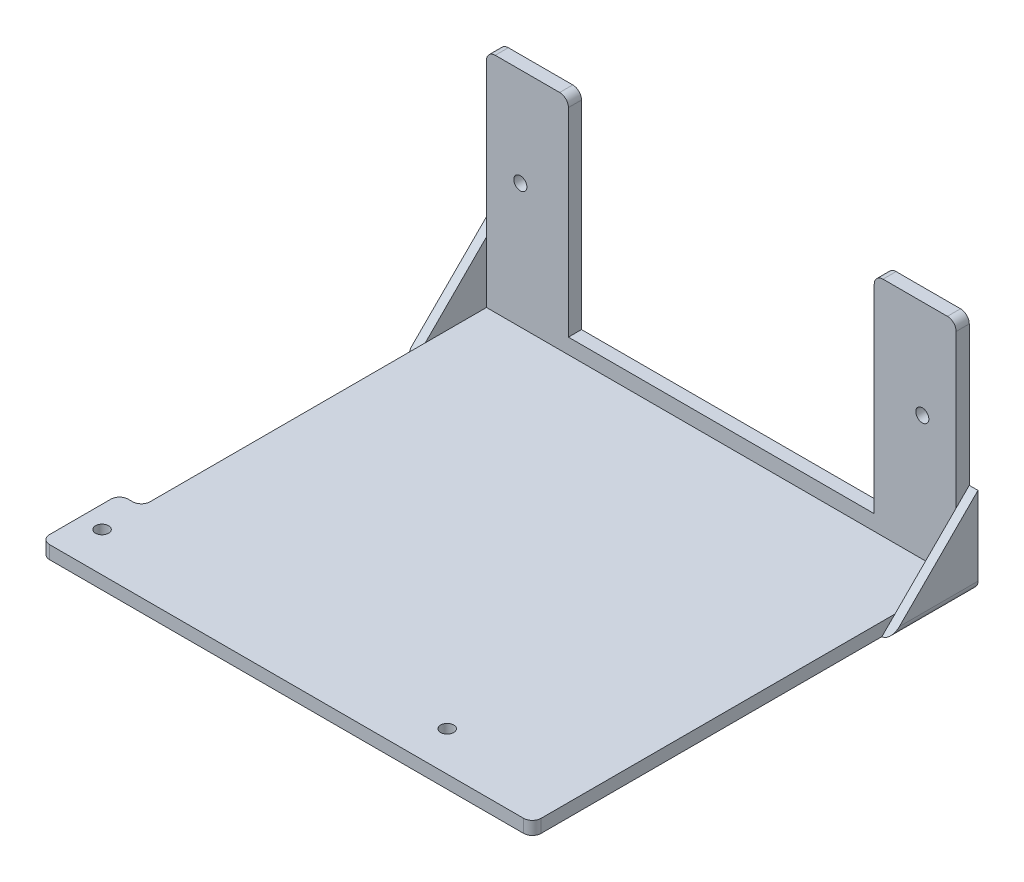
from build123d import *

# Parameters (mm, degrees)
SKETCH_1_W          = 107.5
SKETCH_1_H          = 54
EXTRUDE_1_DEPTH     = 3
SKETCH_2_W          = 107.5
SKETCH_2_H          = 3
EXTRUDE_2_DEPTH     = 97
SKETCH_4_W          = 5
SKETCH_4_H          = 18
EXTRUDE_3_DEPTH     = 3
SKETCH_5_R          = 1.5
CUT_EXTRUDE_1_DEPTH = 3
SKETCH_6_W          = 70
SKETCH_6_H          = 47.5
CUT_EXTRUDE_2_DEPTH = 3
SKETCH_7_R          = 1.5
CUT_EXTRUDE_3_DEPTH = 3
EXTRUDE_4_DEPTH     = 2
EXTRUDE_5_DEPTH     = 2
FILLET_1_R          = 2
FILLET_2_R          = 2


with BuildPart() as part:
    # 草图1 → 凸台-拉伸1 (new body)
    with BuildSketch(Plane.XY):
        with Locations((0, 27)):
            Rectangle(SKETCH_1_W, SKETCH_1_H)
    extrude(amount=EXTRUDE_1_DEPTH)

    # 草图2 → 凸台-拉伸2 (add)
    with BuildSketch(Plane.XY.offset(3)):
        with Locations((0, 1.5)):
            Rectangle(SKETCH_2_W, SKETCH_2_H)
    extrude(amount=EXTRUDE_2_DEPTH)

    # 草图4 → 凸台-拉伸3 (add)
    with BuildSketch(Plane(origin=(0, 3, 0), x_dir=(1, 0, 0), z_dir=(0, 1, 0))):
        with Locations((-56.25, -91)):
            Rectangle(SKETCH_4_W, SKETCH_4_H)
    extrude(amount=-EXTRUDE_3_DEPTH)

    # 草图5 → 切除-拉伸1 (cut)
    with BuildSketch(Plane(origin=(0, 3, 0), x_dir=(1, 0, 0), z_dir=(0, 1, 0))):
        with Locations(Location((-53.75, -91, 0), (0, 0, 180))):
            Circle(SKETCH_5_R)
        with Locations(Location((25.25, -91, 0), (0, 0, 180))):
            Circle(SKETCH_5_R)
    extrude(amount=-CUT_EXTRUDE_1_DEPTH, mode=Mode.SUBTRACT)

    # 草图6 → 切除-拉伸2 (cut)
    with BuildSketch(Plane.XY.offset(3)):
        with Locations((0, 30.25)):
            Rectangle(SKETCH_6_W, SKETCH_6_H)
    extrude(amount=-CUT_EXTRUDE_2_DEPTH, mode=Mode.SUBTRACT)

    # 草图7 → 切除-拉伸3 (cut)
    with BuildSketch(Plane.XY.offset(3)):
        with Locations((46, 31.5)):
            Circle(SKETCH_7_R)
        with Locations((-46, 31.5)):
            Circle(SKETCH_7_R)
    extrude(amount=-CUT_EXTRUDE_3_DEPTH, mode=Mode.SUBTRACT)

    # 草图8 → 凸台-拉伸4 (add)
    with BuildSketch(Plane.ZY.offset(53.75)):
        Polygon((0, 0), (20, 0), (0, 20), align=None)
    extrude(amount=EXTRUDE_4_DEPTH)

    # 草图9 → 凸台-拉伸5 (add)
    with BuildSketch(Plane(origin=(53.75, 0, 0), x_dir=(0, 0, -1), z_dir=(1, 0, 0))):
        Polygon((0, 0), (0, 20), (-20, 0), align=None)
    extrude(amount=EXTRUDE_5_DEPTH)

    # 圆角1
    fillet_1_edges = [part.edges().sort_by_distance(p)[0] for p in [
        (-55.75, 0, 10),
        (55.75, 0, 10),
        (53.75, 54, 1.5),
        (35, 54, 1.5),
        (-35, 54, 1.5),
        (-53.75, 54, 1.5),
    ]]
    fillet(fillet_1_edges, radius=FILLET_1_R)

    # 圆角2
    fillet_2_edges = [part.edges().sort_by_distance(p)[0] for p in [
        (53.75, 1.5, 100),
        (-53.75, 1.5, 82),
        (-58.75, 1.5, 100),
        (-58.75, 1.5, 82),
    ]]
    fillet(fillet_2_edges, radius=FILLET_2_R)


solid = part.part
